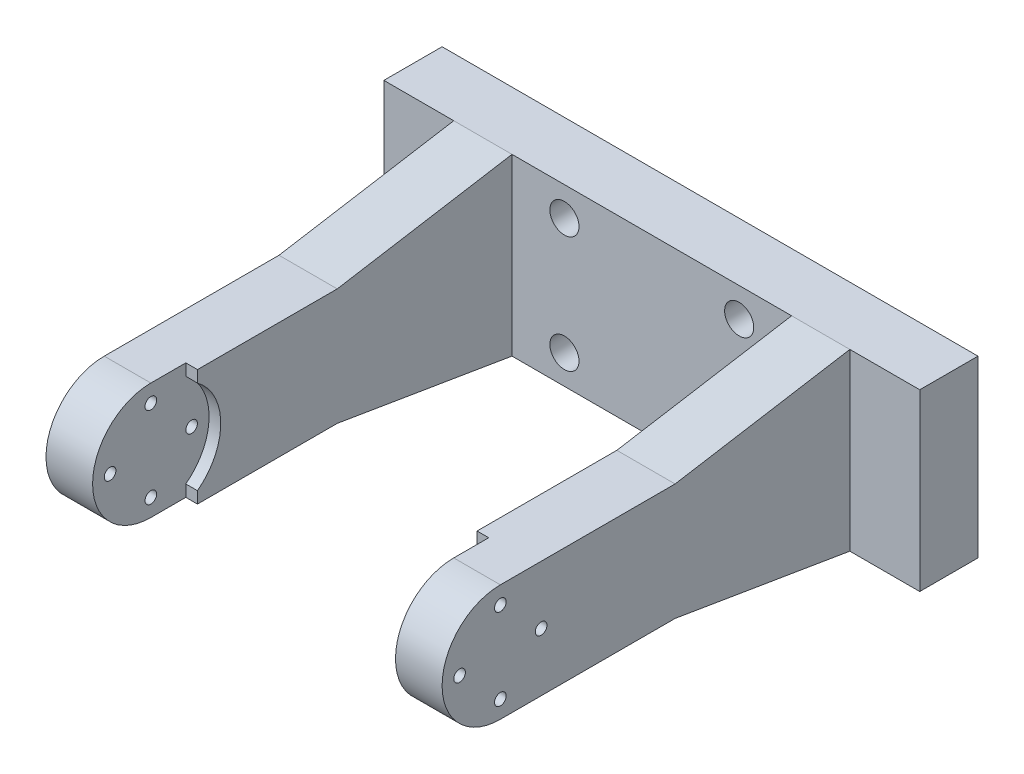
from build123d import *

# Parameters (mm, degrees)
SKETCH1_W           = 92
SKETCH1_H           = 30
BOSS_EXTRUDE1_DEPTH = 10
BOSS_EXTRUDE2_START = -12
BOSS_EXTRUDE2_DEPTH = 10
SKETCH3_R           = 1
CUT_EXTRUDE1_DEPTH  = 10
CUT_EXTRUDE2_DEPTH  = 2
SKETCH7_R           = 2.5
CUT_EXTRUDE3_DEPTH  = 10


with BuildPart() as part:
    # Sketch1 → Boss-Extrude1 (new body)
    with BuildSketch(Plane.XY):
        Rectangle(SKETCH1_W, SKETCH1_H)
    extrude(amount=BOSS_EXTRUDE1_DEPTH)

    # Sketch2 → Boss-Extrude2 (add)
    with BuildSketch(Plane(origin=(46, 0, 0), x_dir=(0, 0, -1), z_dir=(1, 0, 0)).offset(BOSS_EXTRUDE2_START)):
        with BuildLine():
            Line((-10, -15), (-10, 15))
            Line((-10, 15), (-40, 10))
            Line((-40, 10), (-70, 10))
            ThreePointArc((-70, 10), (-62.928932188, 7.071067812), (-60, 0))
            ThreePointArc((-60, 0), (-62.928932188, -7.071067812), (-70, -10))
            Line((-70, -10), (-40, -10))
            Line((-40, -10), (-10, -15))
        make_face()
        with BuildLine():
            ThreePointArc((-60, 0), (-62.928932188, 7.071067812), (-70, 10))
            Line((-70, 10), (-70, -10))
            ThreePointArc((-70, -10), (-62.928932188, -7.071067812), (-60, 0))
        make_face()
        with BuildLine():
            Line((-70, -10), (-70, 10))
            ThreePointArc((-70, 10), (-80, 0), (-70, -10))
        make_face()
    boss_extrude2 = extrude(amount=-BOSS_EXTRUDE2_DEPTH)

    # Sketch3 → Cut-Extrude1 (cut)
    with BuildSketch(Plane(origin=(34, 0, 0), x_dir=(0, 0, -1), z_dir=(1, 0, 0))):
        with Locations((-70, 7)):
            Circle(SKETCH3_R)
        with Locations((-63, 0)):
            Circle(SKETCH3_R)
        with Locations((-70, -7)):
            Circle(SKETCH3_R)
        with Locations((-77, 0)):
            Circle(SKETCH3_R)
    cut_extrude1 = extrude(amount=-CUT_EXTRUDE1_DEPTH, mode=Mode.SUBTRACT)

    # Mirror1: Boss-Extrude2, Cut-Extrude1 across plane
    add(boss_extrude2.mirror(Plane(origin=(0, 0, 0), x_dir=(0, 0, 1), z_dir=(1, 0, 0))))
    add(cut_extrude1.mirror(Plane(origin=(0, 0, 0), x_dir=(0, 0, 1), z_dir=(1, 0, 0))), mode=Mode.SUBTRACT)

    # Sketch6 → Cut-Extrude2 (cut)
    with BuildSketch(Plane.ZY.offset(-24)):
        with BuildLine():
            Line((70, 10), (64, 10))
            Line((64, 10), (64, 8))
            ThreePointArc((64, 8), (60, 0), (64, -8))
            Line((64, -8), (64, -10))
            Line((64, -10), (70, -10))
            ThreePointArc((70, -10), (80, 0), (70, 10))
        make_face()
    cut_extrude2 = extrude(amount=-CUT_EXTRUDE2_DEPTH, mode=Mode.SUBTRACT)

    # Mirror2: Cut-Extrude2 across plane
    add(cut_extrude2.mirror(Plane(origin=(0, 0, 0), x_dir=(0, 0, 1), z_dir=(1, 0, 0))), mode=Mode.SUBTRACT)

    # Sketch7 → Cut-Extrude3 (cut)
    with BuildSketch(Plane.XY.offset(10)):
        with Locations((-15, 10)):
            Circle(SKETCH7_R)
        with Locations((15, 10)):
            Circle(SKETCH7_R)
        with Locations((-15, -10)):
            Circle(SKETCH7_R)
        with Locations((15, -10)):
            Circle(SKETCH7_R)
    extrude(amount=-CUT_EXTRUDE3_DEPTH, mode=Mode.SUBTRACT)


solid = part.part
